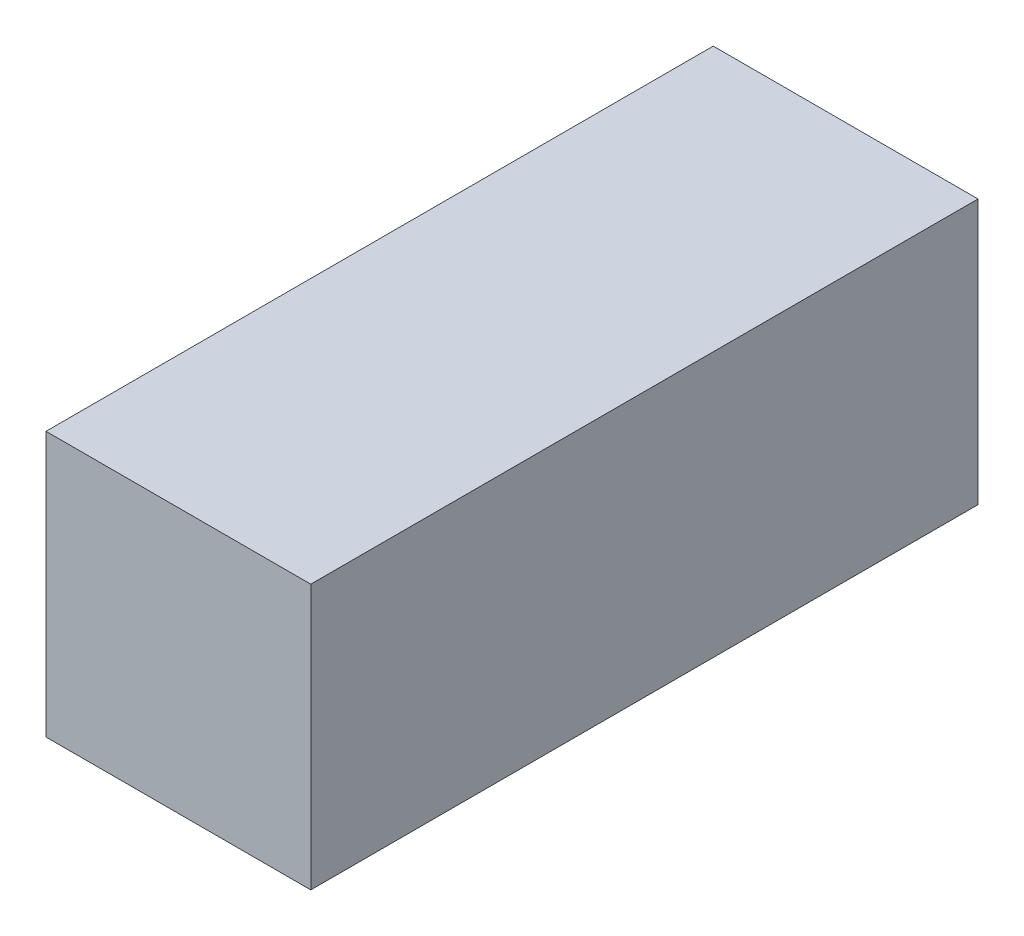
from build123d import *

# Parameters (mm, degrees)
SKETCH1_W           = 1270
SKETCH1_H           = 1270
BOSS_EXTRUDE1_DEPTH = 3200.4


with BuildPart() as part:
    # Sketch1 → Boss-Extrude1 (new body)
    with BuildSketch(Plane.XY):
        with Locations((635, 635)):
            Rectangle(SKETCH1_W, SKETCH1_H)
    extrude(amount=BOSS_EXTRUDE1_DEPTH)


solid = part.part
